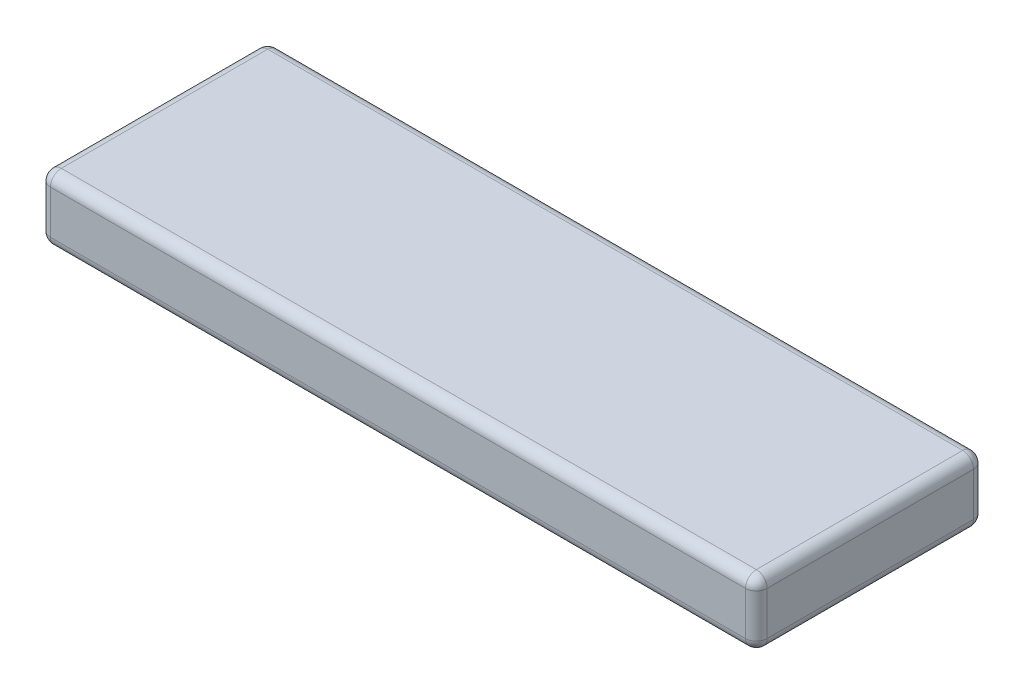
from build123d import *

# Parameters (mm, degrees)
SKETCH1_W           = 132
SKETCH1_H           = 42
BOSS_EXTRUDE1_DEPTH = 12
FILLET1_R           = 2


with BuildPart() as part:
    # Sketch1 → Boss-Extrude1 (new body)
    with BuildSketch(Plane(origin=(0, 0, 0), x_dir=(1, 0, 0), z_dir=(0, 1, 0))):
        Rectangle(SKETCH1_W, SKETCH1_H)
    extrude(amount=BOSS_EXTRUDE1_DEPTH)

    # Fillet1
    fillet1_edges = [part.edges().sort_by_distance(p)[0] for p in [
        (-66, 12, 0),
        (0, 12, 21),
        (66, 12, 0),
        (0, 0, 21),
        (-66, 0, 0),
        (0, 0, -21),
        (66, 0, 0),
        (66, 6, 21),
        (-66, 6, 21),
        (-66, 6, -21),
        (66, 6, -21),
        (0, 12, -21),
    ]]
    fillet(fillet1_edges, radius=FILLET1_R)


solid = part.part
